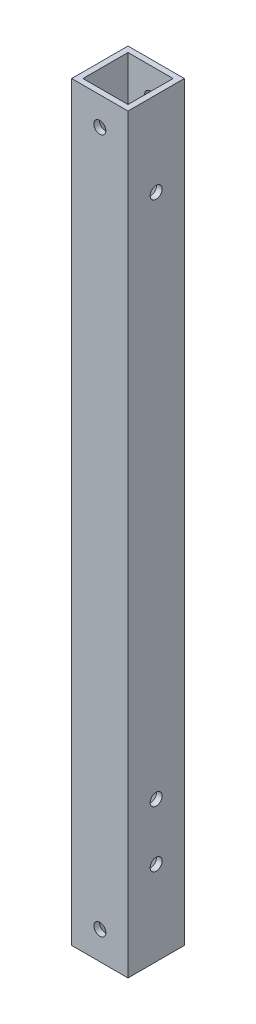
from build123d import *

# Parameters (mm, degrees)
SKETCH_1_W          = 15
SKETCH_1_H          = 15
SKETCH_1_W_2        = 12
SKETCH_1_H_2        = 12
EXTRUDE_1_DEPTH     = 200
SKETCH_2_R          = 1.6
CUT_EXTRUDE_1_DEPTH = 201.701893364
SKETCH_3_R          = 1.6
CUT_EXTRUDE_2_DEPTH = 201.701893364


with BuildPart() as part:
    # ｽｹｯﾁ1 → ﾎﾞｽ - 押し出し1 (new body)
    with BuildSketch(Plane(origin=(0, 0, 0), x_dir=(1, 0, 0), z_dir=(0, 1, 0))):
        Rectangle(SKETCH_1_W, SKETCH_1_H)
        Rectangle(SKETCH_1_W_2, SKETCH_1_H_2, mode=Mode.SUBTRACT)
    extrude(amount=EXTRUDE_1_DEPTH)

    # ｽｹｯﾁ2 → ｶｯﾄ - 押し出し1 (cut, through all)
    with BuildSketch(Plane.XY.offset(7.5)):
        with Locations((0, 192.5)):
            Circle(SKETCH_2_R)
        with Locations((0, 7.5)):
            Circle(SKETCH_2_R)
    extrude(amount=-CUT_EXTRUDE_1_DEPTH, mode=Mode.SUBTRACT)

    # ｽｹｯﾁ3 → ｶｯﾄ - 押し出し2 (cut, through all)
    with BuildSketch(Plane(origin=(7.5, 0, 0), x_dir=(0, 0, -1), z_dir=(1, 0, 0))):
        with Locations((0, 177.5)):
            Circle(SKETCH_3_R)
        with Locations((0, 22.5)):
            Circle(SKETCH_3_R)
        with Locations((0, 37.5)):
            Circle(SKETCH_3_R)
    extrude(amount=-CUT_EXTRUDE_2_DEPTH, mode=Mode.SUBTRACT)


solid = part.part
